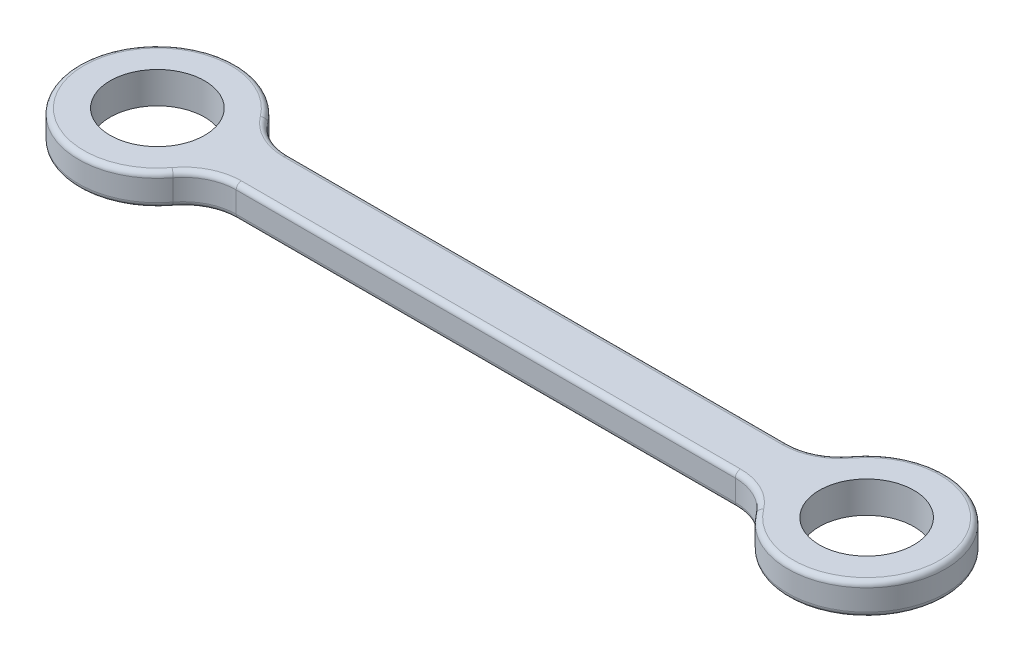
from build123d import *

# Parameters (mm, degrees)
SKETCH1_R           = 9
BOSS_EXTRUDE1_DEPTH = 6
FILLET1_R           = 1


with BuildPart() as part:
    # Sketch1 → Boss-Extrude1 (new body)
    with BuildSketch(Plane(origin=(0, 0, 0), x_dir=(1, 0, 0), z_dir=(0, 1, 0))):
        with BuildLine():
            Line((-28.045977011, 5), (66.954022989, 5))
            ThreePointArc((66.954022989, 5), (71.426158944, 6.05572809), (74.954022989, 9))
            ThreePointArc((74.954022989, 9), (101.954022989, 0), (74.954022989, -9))
            ThreePointArc((74.954022989, -9), (71.426158944, -6.05572809), (66.954022989, -5))
            Line((66.954022989, -5), (-28.045977011, -5))
            ThreePointArc((-28.045977011, -5), (-32.518112966, -6.05572809), (-36.045977011, -9))
            ThreePointArc((-36.045977011, -9), (-63.045977011, 0), (-36.045977011, 9))
            ThreePointArc((-36.045977011, 9), (-32.518112966, 6.05572809), (-28.045977011, 5))
        make_face()
        with Locations(Location((-48.045977011, 0, 0), (0, 0, 270))):
            Circle(SKETCH1_R, mode=Mode.SUBTRACT)
        with Locations(Location((86.954022989, 0, 0), (0, 0, 270))):
            Circle(SKETCH1_R, mode=Mode.SUBTRACT)
    extrude(amount=BOSS_EXTRUDE1_DEPTH)

    # Fillet1
    fillet1_edges = [part.edges().sort_by_distance(p)[0] for p in [
        (-63.045977011, 0, 0),
        (-32.518112966, 0, -6.05572809),
        (19.454022989, 0, -5),
        (71.426158944, 0, -6.05572809),
        (-32.518112966, 6, -6.05572809),
        (-63.045977011, 6, 0),
        (-32.518112966, 6, 6.05572809),
        (19.454022989, 6, 5),
        (71.426158944, 6, 6.05572809),
        (101.954022989, 6, 0),
        (71.426158944, 6, -6.05572809),
        (101.954022989, 0, 0),
        (19.454022989, 6, -5),
        (71.426158944, 0, 6.05572809),
        (19.454022989, 0, 5),
        (-32.518112966, 0, 6.05572809),
    ]]
    fillet(fillet1_edges, radius=FILLET1_R)


solid = part.part
